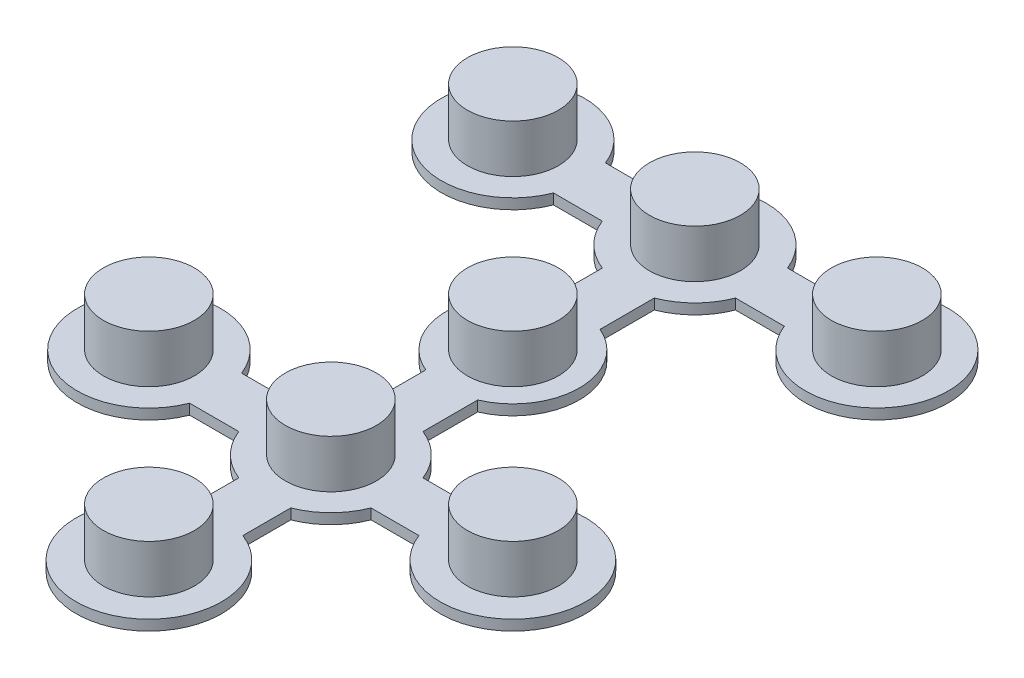
from build123d import *

# Parameters (mm, degrees)
BOSS_EXTRUDE1_DEPTH = 0.4
SKETCH2_R           = 1.75
BOSS_EXTRUDE2_DEPTH = 1.85


with BuildPart() as part:
    # Sketch1 → Boss-Extrude1 (new body)
    with BuildSketch(Plane(origin=(0, 0, 0), x_dir=(1, 0, 0), z_dir=(0, 1, 0))):
        with BuildLine():
            Line((2.561737691, 1), (4.438262309, 1))
            ThreePointArc((4.438262309, 1), (7, 2.75), (9.561737691, 1))
            Line((9.561737691, 1), (11.438262309, 1))
            ThreePointArc((11.438262309, 1), (16.75, 0), (11.438262309, -1))
            Line((11.438262309, -1), (9.561737691, -1))
            ThreePointArc((9.561737691, -1), (8.944543648, -1.944543648), (8, -2.561737691))
            Line((8, -2.561737691), (8, -4.647588392))
            ThreePointArc((8, -4.647588392), (9.556137785, -7), (8, -9.352411608))
            Line((8, -9.352411608), (8, -11.456717793))
            ThreePointArc((8, -11.456717793), (8.932392867, -12.067607133), (9.543282207, -13))
            Line((9.543282207, -13), (11.386254927, -13))
            ThreePointArc((11.386254927, -13), (16.798510909, -14), (11.386254927, -15))
            Line((11.386254927, -15), (9.543282207, -15))
            ThreePointArc((9.543282207, -15), (8.932392867, -15.932392867), (8, -16.543282207))
            Line((8, -16.543282207), (8, -18.386254927))
            ThreePointArc((8, -18.386254927), (7, -23.798510909), (6, -18.386254927))
            Line((6, -18.386254927), (6, -16.543282207))
            ThreePointArc((6, -16.543282207), (5.067607133, -15.932392867), (4.456717793, -15))
            Line((4.456717793, -15), (2.566233649, -15))
            ThreePointArc((2.566233649, -15), (-2.754188654, -14), (2.566233649, -13))
            Line((2.566233649, -13), (4.456717793, -13))
            ThreePointArc((4.456717793, -13), (5.067607133, -12.067607133), (6, -11.456717793))
            Line((6, -11.456717793), (6, -9.352411608))
            ThreePointArc((6, -9.352411608), (4.443862215, -7), (6, -4.647588392))
            Line((6, -4.647588392), (6, -2.561737691))
            ThreePointArc((6, -2.561737691), (5.055456352, -1.944543648), (4.438262309, -1))
            Line((4.438262309, -1), (2.561737691, -1))
            ThreePointArc((2.561737691, -1), (-2.75, 0), (2.561737691, 1))
        make_face()
    extrude(amount=BOSS_EXTRUDE1_DEPTH)

    # Sketch2 → Boss-Extrude2 (add)
    with BuildSketch(Plane(origin=(0, 0.4, 0), x_dir=(1, 0, 0), z_dir=(0, 1, 0))):
        with Locations(Location((0, 0, 0), (0, 0, 270))):
            Circle(SKETCH2_R)
        with Locations(Location((7, 0, 0), (0, 0, 270))):
            Circle(SKETCH2_R)
        with Locations(Location((14, 0, 0), (0, 0, 270))):
            Circle(SKETCH2_R)
        with Locations(Location((7, -7, 0), (0, 0, 270))):
            Circle(SKETCH2_R)
        with Locations(Location((7, -14, 0), (0, 0, 270))):
            Circle(SKETCH2_R)
        with Locations(Location((14, -14, 0), (0, 0, 270))):
            Circle(SKETCH2_R)
        with Locations(Location((0, -14, 0), (0, 0, 270))):
            Circle(SKETCH2_R)
        with Locations(Location((7, -21, 0), (0, 0, 270))):
            Circle(SKETCH2_R)
    extrude(amount=BOSS_EXTRUDE2_DEPTH)


solid = part.part
